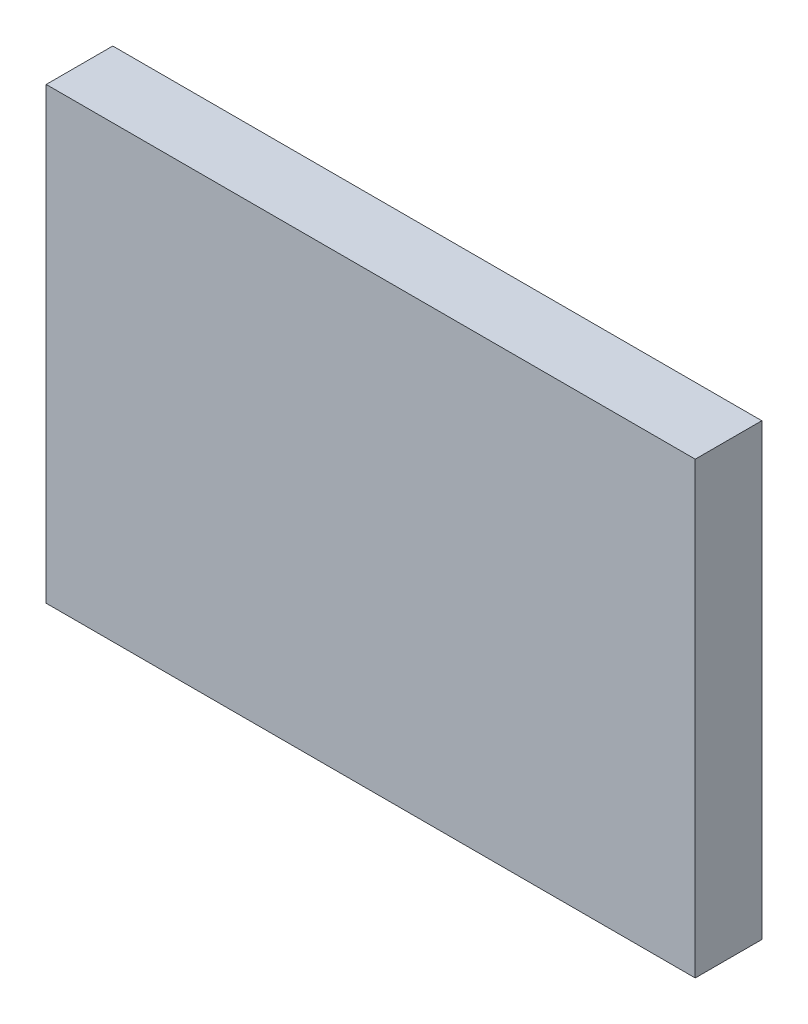
from build123d import *

# Parameters (mm, degrees)
SKETCH1_W           = 390
SKETCH1_H           = 270
BOSS_EXTRUDE1_DEPTH = 40


with BuildPart() as part:
    # Sketch1 → Boss-Extrude1 (new body)
    with BuildSketch(Plane.XY):
        Rectangle(SKETCH1_W, SKETCH1_H)
    extrude(amount=BOSS_EXTRUDE1_DEPTH)


solid = part.part
